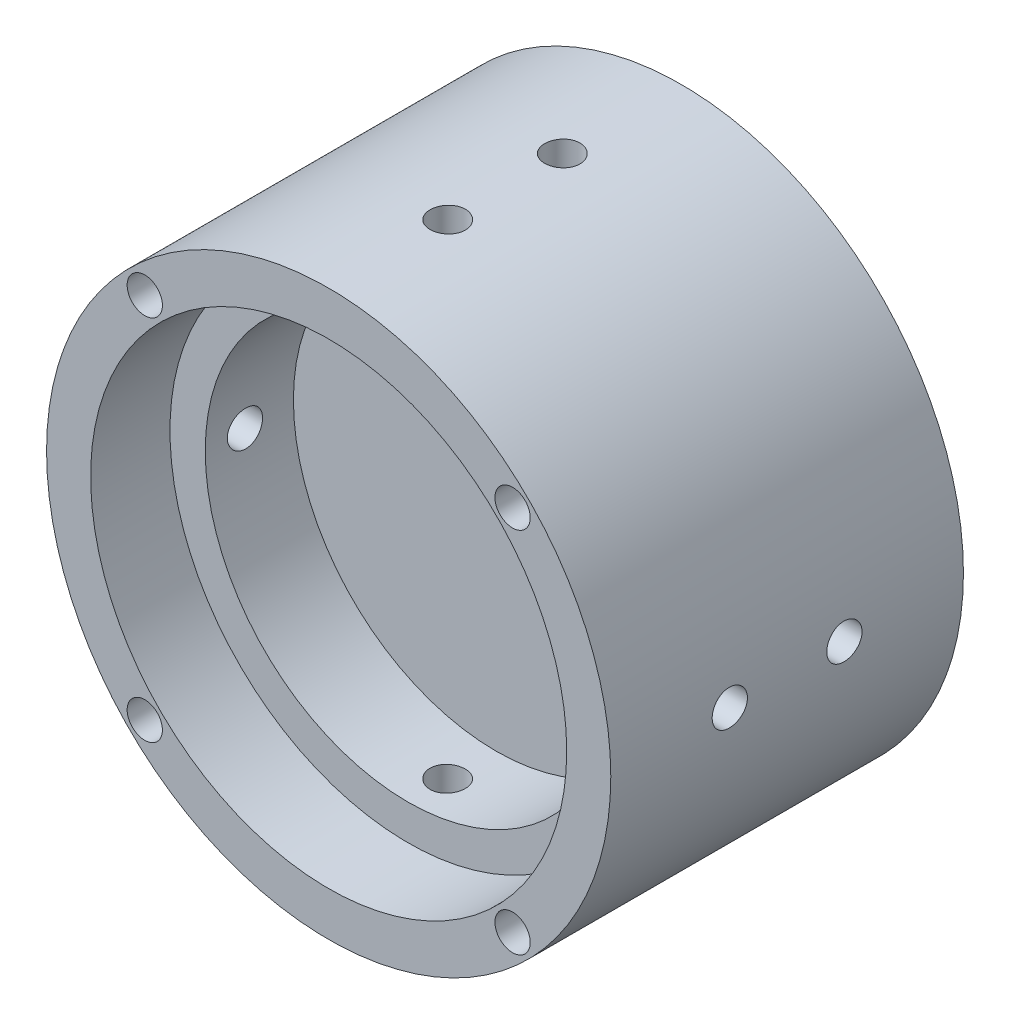
from build123d import *

# Parameters (mm, degrees)
SKETCH1_R                = 80
BOSS_EXTRUDE1_DEPTH      = 100
SKETCH2_R                = 67.5
CUT_EXTRUDE1_DEPTH       = 22.5
SKETCH3_R                = 57.5
CUT_EXTRUDE2_DEPTH       = 25
CUT_EXTRUDE3_DEPTH       = 175
CUT_EXTRUDE3_DEPTH_BACK  = 184
SKETCH6_R                = 5
CUT_EXTRUDE4_DEPTH       = 233
CUT_EXTRUDE4_DEPTH_BACK  = 199
SKETCH7_R                = 5
CUT_EXTRUDE5_START       = 22.5
SKETCH8_R                = 67.5
CUT_EXTRUDE5_DEPTH       = 22.5
CUT_EXTRUDE6_START       = 45
SKETCH9_R                = 57.5
CUT_EXTRUDE6_DEPTH       = 45
SKETCH10_R               = 5
CUT_EXTRUDE9_DEPTH       = 114
CUT_EXTRUDE10_DEPTH      = 87
CUT_EXTRUDE10_DEPTH_BACK = 116
SKETCH11_R               = 5
CUT_EXTRUDE11_DEPTH      = 94
CUT_EXTRUDE11_DEPTH_BACK = 109
SKETCH12_R               = 5


with BuildPart() as part:
    # Sketch1 → Boss-Extrude1 (new body)
    with BuildSketch(Plane.XY):
        Circle(SKETCH1_R)
    extrude(amount=BOSS_EXTRUDE1_DEPTH)

    # Sketch2 → Cut-Extrude1 (cut)
    with BuildSketch(Plane.XY.offset(100)):
        Circle(SKETCH2_R)
    extrude(amount=-CUT_EXTRUDE1_DEPTH, mode=Mode.SUBTRACT)

    # Sketch3 → Cut-Extrude2 (cut)
    with BuildSketch(Plane.XY.offset(77.5)):
        Circle(SKETCH3_R)
    extrude(amount=-CUT_EXTRUDE2_DEPTH, mode=Mode.SUBTRACT)

    # Sketch6 → Cut-Extrude3 (cut, two sides: drawn at the far end of the back side and taken through both)
    with BuildSketch(Plane(origin=(0, 0, 0), x_dir=(1, 0, 0), z_dir=(0, 1, 0)).offset(-CUT_EXTRUDE3_DEPTH_BACK)):
        with Locations(Location((0, -66.25, 0), (0, 0, 90))):
            Circle(SKETCH6_R)
    extrude(amount=CUT_EXTRUDE3_DEPTH + CUT_EXTRUDE3_DEPTH_BACK, mode=Mode.SUBTRACT)

    # Sketch7 → Cut-Extrude4 (cut, two sides: drawn at the far end of the back side and taken through both)
    with BuildSketch(Plane(origin=(0, 0, 0), x_dir=(0, 0, -1), z_dir=(1, 0, 0)).offset(-CUT_EXTRUDE4_DEPTH_BACK)):
        with Locations(Location((-66.25, 0, 0), (0, 0, 180))):
            Circle(SKETCH7_R)
    extrude(amount=CUT_EXTRUDE4_DEPTH + CUT_EXTRUDE4_DEPTH_BACK, mode=Mode.SUBTRACT)

    # Sketch8 → Cut-Extrude5 (cut)
    with BuildSketch(Plane.XY.offset(CUT_EXTRUDE5_START)):
        Circle(SKETCH8_R)
    extrude(amount=-CUT_EXTRUDE5_DEPTH, mode=Mode.SUBTRACT)

    # Sketch9 → Cut-Extrude6 (cut)
    with BuildSketch(Plane.XY.offset(CUT_EXTRUDE6_START)):
        Circle(SKETCH9_R)
    extrude(amount=-CUT_EXTRUDE6_DEPTH, mode=Mode.SUBTRACT)

    # Sketch10 → Cut-Extrude9 (cut)
    with BuildSketch(Plane.XY):
        with Locations((-52.149125113, 52.149125113)):
            Circle(SKETCH10_R)
        with Locations((52.149125113, 52.149125113)):
            Circle(SKETCH10_R)
        with Locations((52.149125113, -52.149125113)):
            Circle(SKETCH10_R)
        with Locations((-52.149125113, -52.149125113)):
            Circle(SKETCH10_R)
    extrude(amount=CUT_EXTRUDE9_DEPTH, mode=Mode.SUBTRACT)

    # Sketch11 → Cut-Extrude10 (cut, two sides: drawn at the far end of the back side and taken through both)
    with BuildSketch(Plane(origin=(0, 0, 0), x_dir=(0, 0, -1), z_dir=(1, 0, 0)).offset(-CUT_EXTRUDE10_DEPTH_BACK)):
        with Locations(Location((-33.75, 0, 0), (0, 0, 180))):
            Circle(SKETCH11_R)
    extrude(amount=CUT_EXTRUDE10_DEPTH + CUT_EXTRUDE10_DEPTH_BACK, mode=Mode.SUBTRACT)

    # Sketch12 → Cut-Extrude11 (cut, two sides: drawn at the far end of the back side and taken through both)
    with BuildSketch(Plane(origin=(0, 0, 0), x_dir=(1, 0, 0), z_dir=(0, 1, 0)).offset(-CUT_EXTRUDE11_DEPTH_BACK)):
        with Locations(Location((0, -33.75, 0), (0, 0, 90))):
            Circle(SKETCH12_R)
    extrude(amount=CUT_EXTRUDE11_DEPTH + CUT_EXTRUDE11_DEPTH_BACK, mode=Mode.SUBTRACT)


solid = part.part
